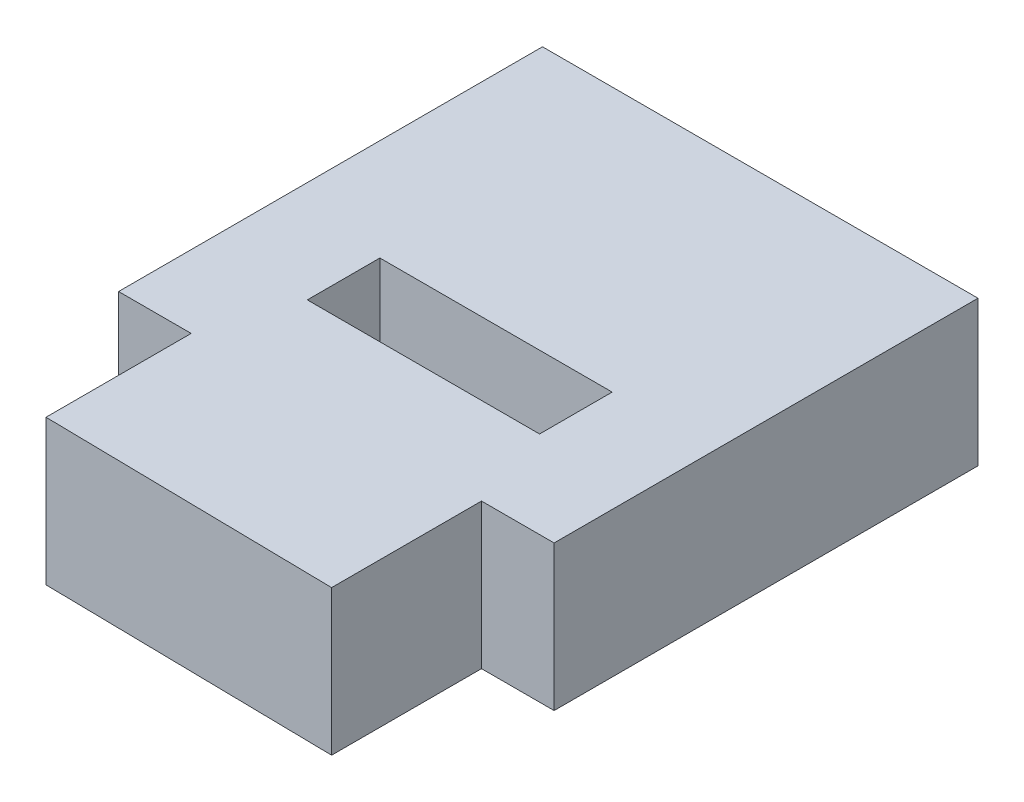
from build123d import *

# Parameters (mm, degrees)
SKETCH1_W           = 10.16
SKETCH1_H           = 3.175
BOSS_EXTRUDE1_DEPTH = 6.35


with BuildPart() as part:
    # Sketch1 → Boss-Extrude1 (new body)
    with BuildSketch(Plane(origin=(0, 0, 0), x_dir=(1, 0, 0), z_dir=(0, 1, 0))):
        Polygon((-9.525, 9.271), (9.525, 9.271), (9.525, -9.271), (6.35, -9.271), (6.35, -15.828536585), (-6.35, -15.621), (-6.35, -9.271), (-9.525, -9.271), align=None)
        with Locations((0, -3.8735)):
            Rectangle(SKETCH1_W, SKETCH1_H, mode=Mode.SUBTRACT)
    extrude(amount=BOSS_EXTRUDE1_DEPTH)


solid = part.part
